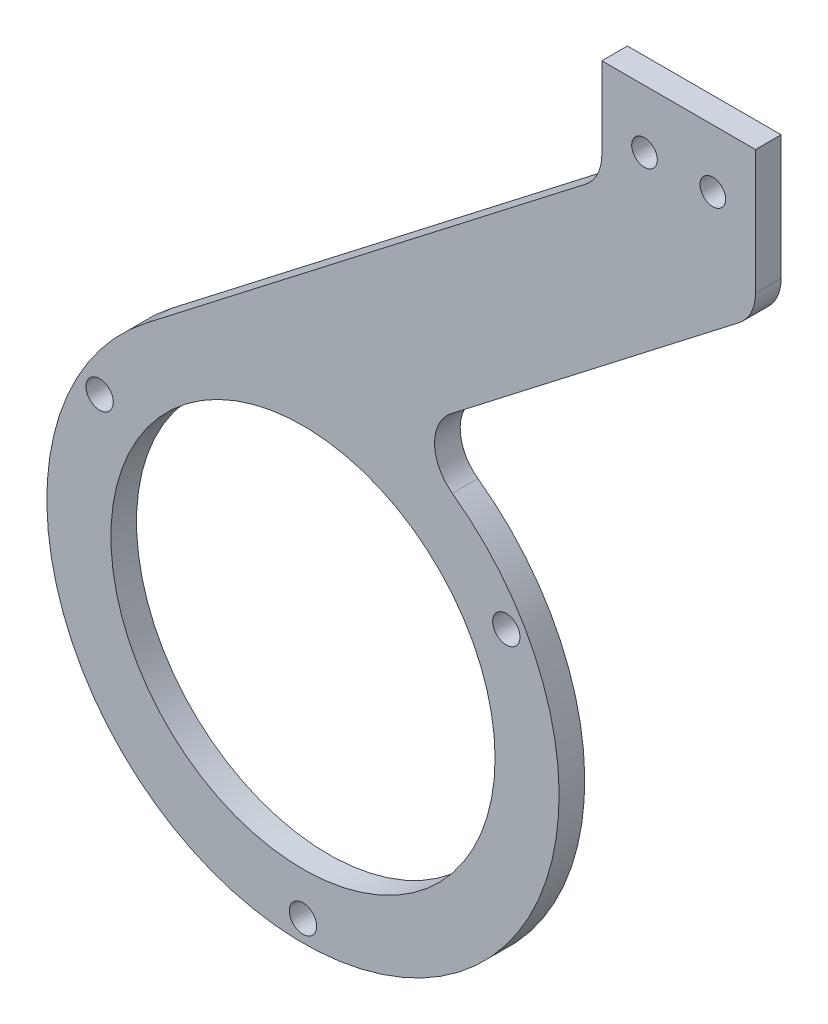
from build123d import *

# Parameters (mm, degrees)
SKETCH_1_R      = 30
SKETCH_1_R_2    = 22.5
SKETCH_1_R_3    = 1.6
EXTRUDE_1_DEPTH = 3
SKETCH_4_R      = 1.5
EXTRUDE_3_DEPTH = 3
FILLET_1_R      = 5
FILLET_2_R      = 5


with BuildPart() as part:
    # 草图1 → 凸台-拉伸1 (new body)
    with BuildSketch(Plane.XY):
        Circle(SKETCH_1_R)
        Circle(SKETCH_1_R_2, mode=Mode.SUBTRACT)
        with Locations((23.815698604, 13.75)):
            Circle(SKETCH_1_R_3, mode=Mode.SUBTRACT)
        with Locations((0, -27.5)):
            Circle(SKETCH_1_R_3, mode=Mode.SUBTRACT)
        with Locations((-23.815698604, 13.75)):
            Circle(SKETCH_1_R_3, mode=Mode.SUBTRACT)
    extrude(amount=EXTRUDE_1_DEPTH)

    # 草图4 → 凸台-拉伸3 (add)
    with BuildSketch(Plane.XY.offset(3)):
        with BuildLine():
            Line((-18.354989219, 23.729609579), (35, 65))
            Line((35, 65), (35, 77))
            Line((35, 77), (53, 77))
            Line((53, 77), (53, 59.959453772))
            Line((53, 59.959453772), (11.372950108, 27.760691739))
            Line((11.372950108, 27.760691739), (1.135189229, 26.37246046))
            ThreePointArc((1.135189229, 26.37246046), (-0.214991049, 29.085490097), (-0.793931536, 26.110873398))
            Line((-0.793931536, 26.110873398), (-18.354989219, 23.729609579))
        make_face()
        with Locations((40, 70.2)):
            Circle(SKETCH_4_R, mode=Mode.SUBTRACT)
        with Locations((48, 70.2)):
            Circle(SKETCH_4_R, mode=Mode.SUBTRACT)
    extrude(amount=-EXTRUDE_3_DEPTH)

    # 圆角1
    fillet_1_edges = [part.edges().sort_by_distance(p)[0] for p in [
        (11.372950108, 27.760691739, 1.5),
    ]]
    fillet(fillet_1_edges, radius=FILLET_1_R)

    # 圆角2
    fillet_2_edges = [part.edges().sort_by_distance(p)[0] for p in [
        (35, 65, 1.5),
        (53, 59.959453772, 1.5),
    ]]
    fillet(fillet_2_edges, radius=FILLET_2_R)


solid = part.part
